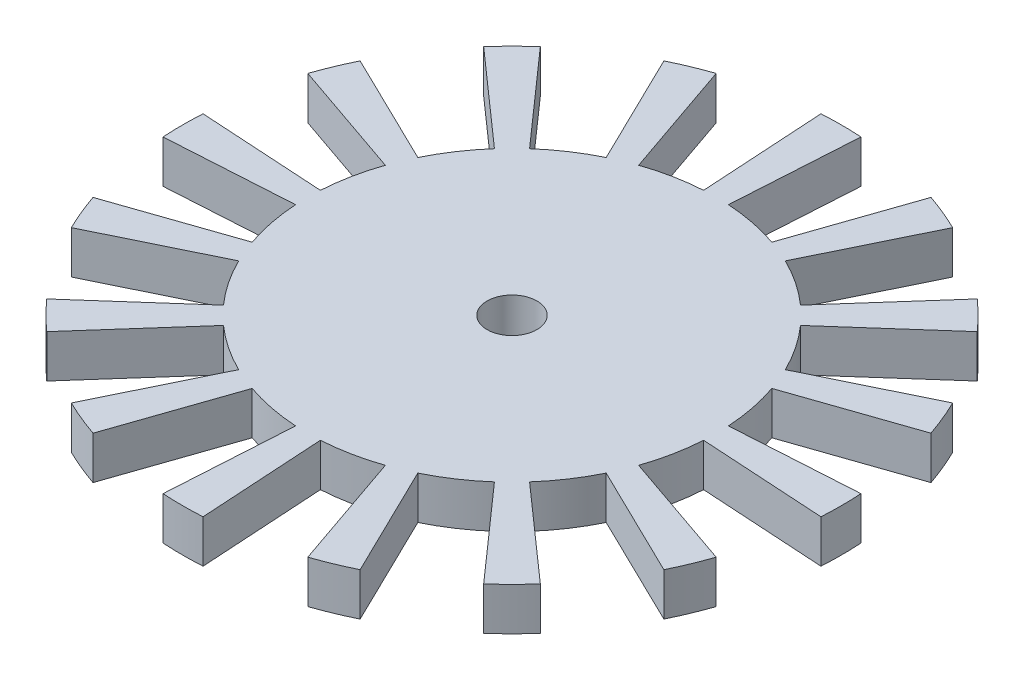
from build123d import *

# Parameters (mm, degrees)
SKETCH2_R           = 2.9845
BOSS_EXTRUDE1_DEPTH = 5.1308


with BuildPart() as part:
    # Sketch2 → Boss-Extrude1 (new body)
    with BuildSketch(Plane(origin=(0, 0, 0), x_dir=(1, 0, 0), z_dir=(0, 1, 0))):
        with BuildLine():
            Line((-17.306656678, 35.509756676), (-10.733030501, 22.022006247))
            ThreePointArc((-10.733030501, 22.022006247), (-13.61052624, 20.369592003), (-16.238327885, 18.34348414))
            Line((-16.238327885, 18.34348414), (-26.183766617, 29.578261448))
            ThreePointArc((-26.183766617, 29.578261448), (-27.932625947, 27.932625947), (-29.578261448, 26.183766617))
            Line((-29.578261448, 26.183766617), (-18.34348414, 16.238327885))
            ThreePointArc((-18.34348414, 16.238327885), (-20.369592003, 13.61052624), (-22.022006247, 10.733030501))
            Line((-22.022006247, 10.733030501), (-35.509756676, 17.306656678))
            ThreePointArc((-35.509756676, 17.306656678), (-36.495734573, 15.117028229), (-37.34684404, 12.871535447))
            Line((-37.34684404, 12.871535447), (-23.161308603, 7.982511303))
            ThreePointArc((-23.161308603, 7.982511303), (-24.027572035, 4.779381236), (-24.453033788, 1.488570263))
            Line((-24.453033788, 1.488570263), (-39.429708177, 2.400270314))
            ThreePointArc((-39.429708177, 2.400270314), (-39.502698446, 0), (-39.429708177, -2.400270314))
            Line((-39.429708177, -2.400270314), (-24.453033788, -1.488570263))
            ThreePointArc((-24.453033788, -1.488570263), (-24.027572035, -4.779381236), (-23.161308603, -7.982511303))
            Line((-23.161308603, -7.982511303), (-37.34684404, -12.871535447))
            ThreePointArc((-37.34684404, -12.871535447), (-36.495734573, -15.117028229), (-35.509756676, -17.306656678))
            Line((-35.509756676, -17.306656678), (-22.022006247, -10.733030501))
            ThreePointArc((-22.022006247, -10.733030501), (-20.369592003, -13.61052624), (-18.34348414, -16.238327885))
            Line((-18.34348414, -16.238327885), (-29.578261448, -26.183766617))
            ThreePointArc((-29.578261448, -26.183766617), (-27.932625947, -27.932625947), (-26.183766617, -29.578261448))
            Line((-26.183766617, -29.578261448), (-16.238327885, -18.34348414))
            ThreePointArc((-16.238327885, -18.34348414), (-13.61052624, -20.369592003), (-10.733030501, -22.022006247))
            Line((-10.733030501, -22.022006247), (-17.306656678, -35.509756676))
            ThreePointArc((-17.306656678, -35.509756676), (-15.117028229, -36.495734573), (-12.871535447, -37.34684404))
            Line((-12.871535447, -37.34684404), (-7.982511303, -23.161308603))
            ThreePointArc((-7.982511303, -23.161308603), (-4.779381236, -24.027572035), (-1.488570263, -24.453033788))
            Line((-1.488570263, -24.453033788), (-2.400270314, -39.429708177))
            ThreePointArc((-2.400270314, -39.429708177), (0, -39.502698446), (2.400270314, -39.429708177))
            Line((2.400270314, -39.429708177), (1.488570263, -24.453033788))
            ThreePointArc((1.488570263, -24.453033788), (4.779381236, -24.027572035), (7.982511303, -23.161308603))
            Line((7.982511303, -23.161308603), (12.871535447, -37.34684404))
            ThreePointArc((12.871535447, -37.34684404), (15.117028229, -36.495734573), (17.306656678, -35.509756676))
            Line((17.306656678, -35.509756676), (10.733030501, -22.022006247))
            ThreePointArc((10.733030501, -22.022006247), (13.61052624, -20.369592003), (16.238327885, -18.34348414))
            Line((16.238327885, -18.34348414), (26.183766617, -29.578261448))
            ThreePointArc((26.183766617, -29.578261448), (27.932625947, -27.932625947), (29.578261448, -26.183766617))
            Line((29.578261448, -26.183766617), (18.34348414, -16.238327885))
            ThreePointArc((18.34348414, -16.238327885), (20.369592003, -13.61052624), (22.022006247, -10.733030501))
            Line((22.022006247, -10.733030501), (35.509756676, -17.306656678))
            ThreePointArc((35.509756676, -17.306656678), (36.495734573, -15.117028229), (37.34684404, -12.871535447))
            Line((37.34684404, -12.871535447), (23.161308603, -7.982511303))
            ThreePointArc((23.161308603, -7.982511303), (24.027572035, -4.779381236), (24.453033788, -1.488570263))
            Line((24.453033788, -1.488570263), (39.429708177, -2.400270314))
            ThreePointArc((39.429708177, -2.400270314), (39.502698446, 0), (39.429708177, 2.400270314))
            Line((39.429708177, 2.400270314), (24.453033788, 1.488570263))
            ThreePointArc((24.453033788, 1.488570263), (24.027572035, 4.779381236), (23.161308603, 7.982511303))
            Line((23.161308603, 7.982511303), (37.34684404, 12.871535447))
            ThreePointArc((37.34684404, 12.871535447), (36.495734573, 15.117028229), (35.509756676, 17.306656678))
            Line((35.509756676, 17.306656678), (22.022006247, 10.733030501))
            ThreePointArc((22.022006247, 10.733030501), (20.369592003, 13.61052624), (18.34348414, 16.238327885))
            Line((18.34348414, 16.238327885), (29.578261448, 26.183766617))
            ThreePointArc((29.578261448, 26.183766617), (27.932625947, 27.932625947), (26.183766617, 29.578261448))
            Line((26.183766617, 29.578261448), (16.238327885, 18.34348414))
            ThreePointArc((16.238327885, 18.34348414), (13.61052624, 20.369592003), (10.733030501, 22.022006247))
            Line((10.733030501, 22.022006247), (17.306656678, 35.509756676))
            ThreePointArc((17.306656678, 35.509756676), (15.117028229, 36.495734573), (12.871535447, 37.34684404))
            Line((12.871535447, 37.34684404), (7.982511303, 23.161308603))
            ThreePointArc((7.982511303, 23.161308603), (4.779381236, 24.027572035), (1.488570263, 24.453033788))
            Line((1.488570263, 24.453033788), (2.400270314, 39.429708177))
            ThreePointArc((2.400270314, 39.429708177), (0, 39.502698446), (-2.400270314, 39.429708177))
            Line((-2.400270314, 39.429708177), (-1.488570263, 24.453033788))
            ThreePointArc((-1.488570263, 24.453033788), (-4.779381236, 24.027572035), (-7.982511303, 23.161308603))
            Line((-7.982511303, 23.161308603), (-12.871535447, 37.34684404))
            ThreePointArc((-12.871535447, 37.34684404), (-15.117028229, 36.495734573), (-17.306656678, 35.509756676))
        make_face()
        with Locations(Location((0, 0, 0), (0, 0, 270))):
            Circle(SKETCH2_R, mode=Mode.SUBTRACT)
    extrude(amount=BOSS_EXTRUDE1_DEPTH)


solid = part.part
